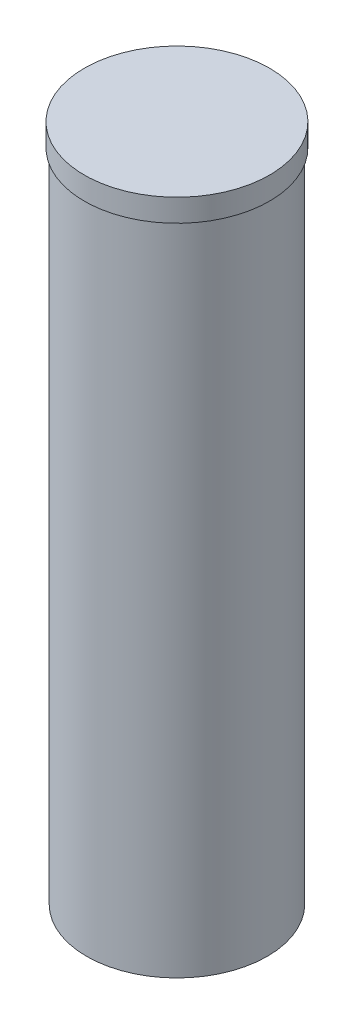
from build123d import *

# Parameters (mm, degrees)
SKETCH_1_W   = 20
SKETCH_1_H   = 150
SKETCH_1_W_2 = 0.5
SKETCH_1_H_2 = 5


with BuildPart() as part:
    # 草图1 → 旋转2 (revolve)
    with BuildSketch(Plane.XY, mode=Mode.PRIVATE) as revolve_2_sk:
        with Locations((10, 75)):
            Rectangle(SKETCH_1_W, SKETCH_1_H)
        with Locations((20.25, 147.5)):
            Rectangle(SKETCH_1_W_2, SKETCH_1_H_2)
    revolve(revolve_2_sk.sketch.rotate(Axis((0, 0, 0), (0, 1, 0)), 90), axis=Axis((0, 0, 0), (0, 1, 0)))


solid = part.part
